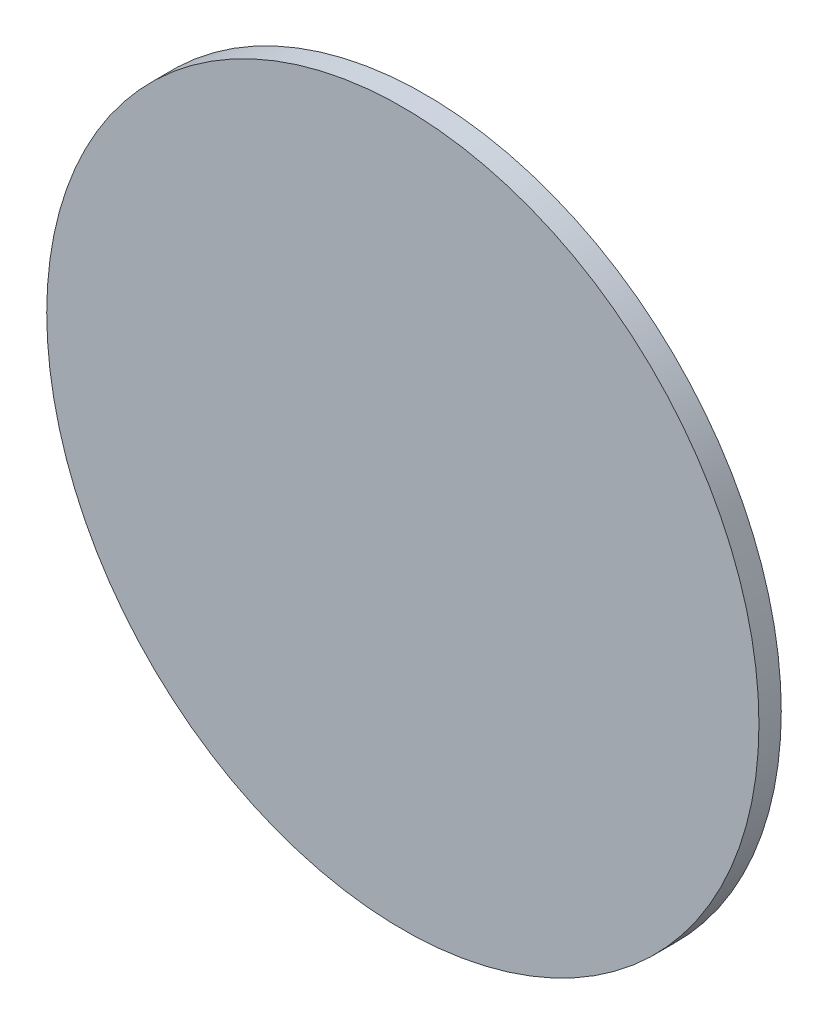
from build123d import *

# Parameters (mm, degrees)
SKETCH1_R      = 15.95
EXTRUDE1_DEPTH = 1


with BuildPart() as part:
    # Sketch1 → Extrude1 (new body)
    with BuildSketch(Plane.XY):
        Circle(SKETCH1_R)
    extrude(amount=EXTRUDE1_DEPTH)


solid = part.part
